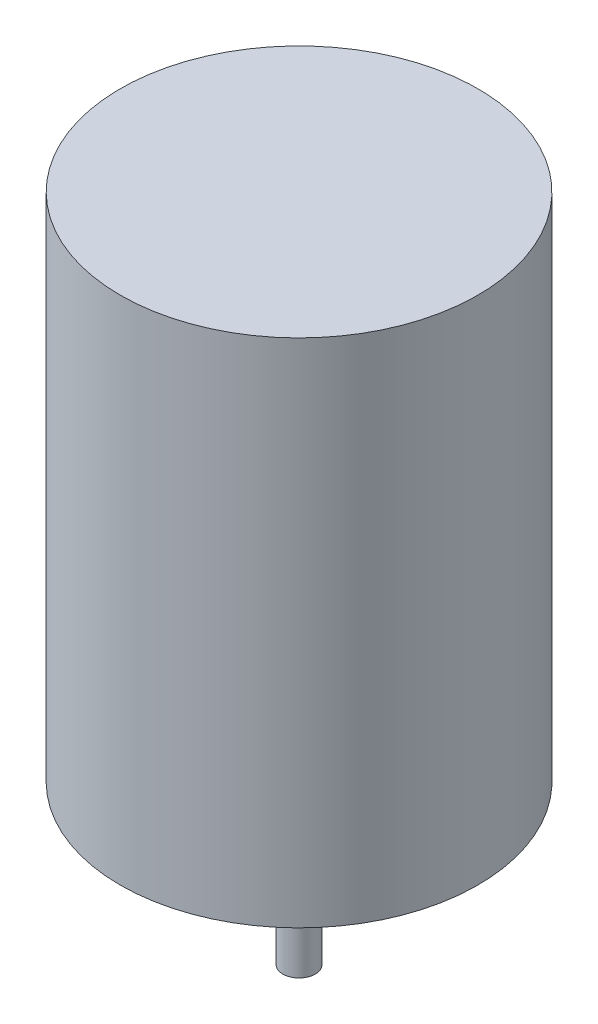
from build123d import *

# Parameters (mm, degrees)
SKETCH1_R           = 17.5
BOSS_EXTRUDE1_DEPTH = 50
SKETCH1_3_R         = 5
BOSS_EXTRUDE2_DEPTH = 2
BOSS_EXTRUDE3_START = -2
SKETCH1_4_R         = 1.5875
BOSS_EXTRUDE3_DEPTH = 13.5
SKETCH1_5_R         = 1.5
CUT_EXTRUDE1_DEPTH  = 13.5


with BuildPart() as part:
    # Sketch1 → Boss-Extrude1 (new body)
    with BuildSketch(Plane(origin=(0, 0, 0), x_dir=(1, 0, 0), z_dir=(0, 1, 0))):
        with Locations(Location((0, 0, 0), (0, 0, 270))):
            Circle(SKETCH1_R)
    extrude(amount=BOSS_EXTRUDE1_DEPTH)

    # Sketch1<3> → Boss-Extrude2 (add)
    with BuildSketch(Plane(origin=(0, 0, 0), x_dir=(1, 0, 0), z_dir=(0, 1, 0))):
        with Locations(Location((0, 0, 0), (0, 0, 270))):
            Circle(SKETCH1_3_R)
    extrude(amount=-BOSS_EXTRUDE2_DEPTH)

    # Sketch1<4> → Boss-Extrude3 (add)
    with BuildSketch(Plane(origin=(0, 0, 0), x_dir=(1, 0, 0), z_dir=(0, 1, 0)).offset(BOSS_EXTRUDE3_START)):
        with Locations(Location((0, 0, 0), (0, 0, 270))):
            Circle(SKETCH1_4_R)
    extrude(amount=-BOSS_EXTRUDE3_DEPTH)

    # Sketch1<5> → Cut-Extrude1 (cut)
    with BuildSketch(Plane(origin=(0, 0, 0), x_dir=(1, 0, 0), z_dir=(0, 1, 0))):
        with Locations(Location((0, -12.5, 0), (0, 0, 270))):
            Circle(SKETCH1_5_R)
        with Locations(Location((0, 12.5, 0), (0, 0, 270))):
            Circle(SKETCH1_5_R)
    extrude(amount=CUT_EXTRUDE1_DEPTH, mode=Mode.SUBTRACT)


solid = part.part
